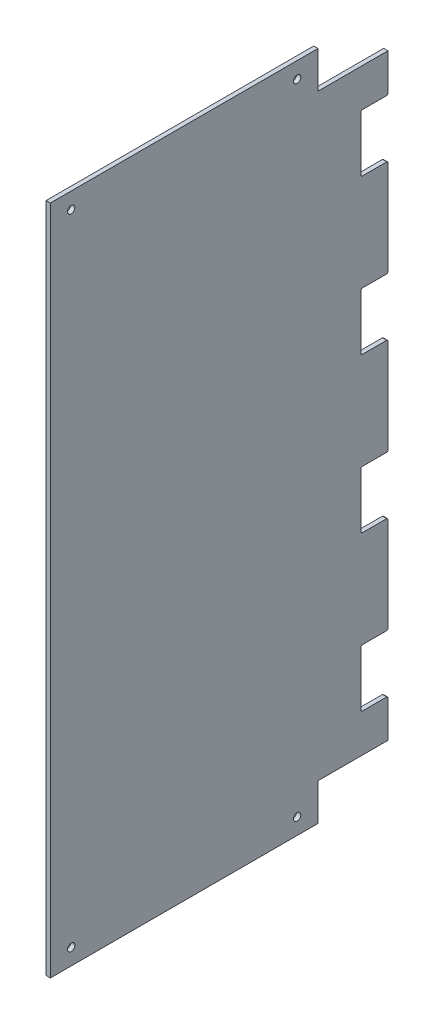
from build123d import *

# Parameters (mm, degrees)
SKETCH1_W           = 500
SKETCH1_H           = 200
SKETCH1_R           = 2.75
BOSS_EXTRUDE1_DEPTH = 3.175
SKETCH2_W           = 500
SKETCH2_H           = 200
SKETCH2_W_2         = 499
SKETCH2_H_2         = 199
CUT_EXTRUDE1_DEPTH  = 3.175
BOSS_EXTRUDE2_DEPTH = 3.175
FILLET1_R           = 1


with BuildPart() as part:
    # Sketch1 → Boss-Extrude1 (new body)
    with BuildSketch(Plane.YZ):
        Rectangle(SKETCH1_W, SKETCH1_H)
        with Locations(Location((237.5, 84, 0), (0, 0, 270))):
            Circle(SKETCH1_R, mode=Mode.SUBTRACT)
        with Locations(Location((-237.5, 84, 0), (0, 0, 270))):
            Circle(SKETCH1_R, mode=Mode.SUBTRACT)
        with Locations(Location((237.5, -84, 0), (0, 0, 270))):
            Circle(SKETCH1_R, mode=Mode.SUBTRACT)
        with Locations(Location((-237.5, -84, 0), (0, 0, 270))):
            Circle(SKETCH1_R, mode=Mode.SUBTRACT)
    extrude(amount=BOSS_EXTRUDE1_DEPTH)

    # Sketch2 → Cut-Extrude1 (cut)
    with BuildSketch(Plane.YZ.offset(3.175)):
        Rectangle(SKETCH2_W, SKETCH2_H)
        Rectangle(SKETCH2_W_2, SKETCH2_H_2, mode=Mode.SUBTRACT)
    extrude(amount=-CUT_EXTRUDE1_DEPTH, mode=Mode.SUBTRACT)

    # Sketch3 → Boss-Extrude2 (add, through all)
    with BuildSketch(Plane.YZ.offset(3.175)):
        Polygon((222, -99.5), (-222, -99.5), (-222, -151.5), (-193.6, -151.5), (-193.6, -131.5), (-150.9, -131.5), (-150.9, -151.5), (-78.77, -151.5), (-78.77, -131.5), (-36.07, -131.5), (-36.07, -151.5), (36.07, -151.5), (36.07, -131.5), (78.77, -131.5), (78.77, -151.5), (150.9, -151.5), (150.9, -131.5), (193.6, -131.5), (193.6, -151.5), (222, -151.5), align=None)
    extrude(amount=-BOSS_EXTRUDE2_DEPTH)

    # Fillet1
    fillet1_edges = [part.edges().sort_by_distance(p)[0] for p in [
        (1.5875, 193.6, -151.5),
        (1.5875, 193.6, -131.5),
        (1.5875, 150.9, -131.5),
        (1.5875, 150.9, -151.5),
        (1.5875, 78.77, -151.5),
        (1.5875, 78.77, -131.5),
        (1.5875, 36.07, -131.5),
        (1.5875, 36.07, -151.5),
        (1.5875, -36.07, -151.5),
        (1.5875, -36.07, -131.5),
        (1.5875, -78.77, -131.5),
        (1.5875, -78.77, -151.5),
        (1.5875, -150.9, -151.5),
        (1.5875, -150.9, -131.5),
        (1.5875, -193.6, -131.5),
        (1.5875, -193.6, -151.5),
    ]]
    fillet(fillet1_edges, radius=FILLET1_R)


solid = part.part
